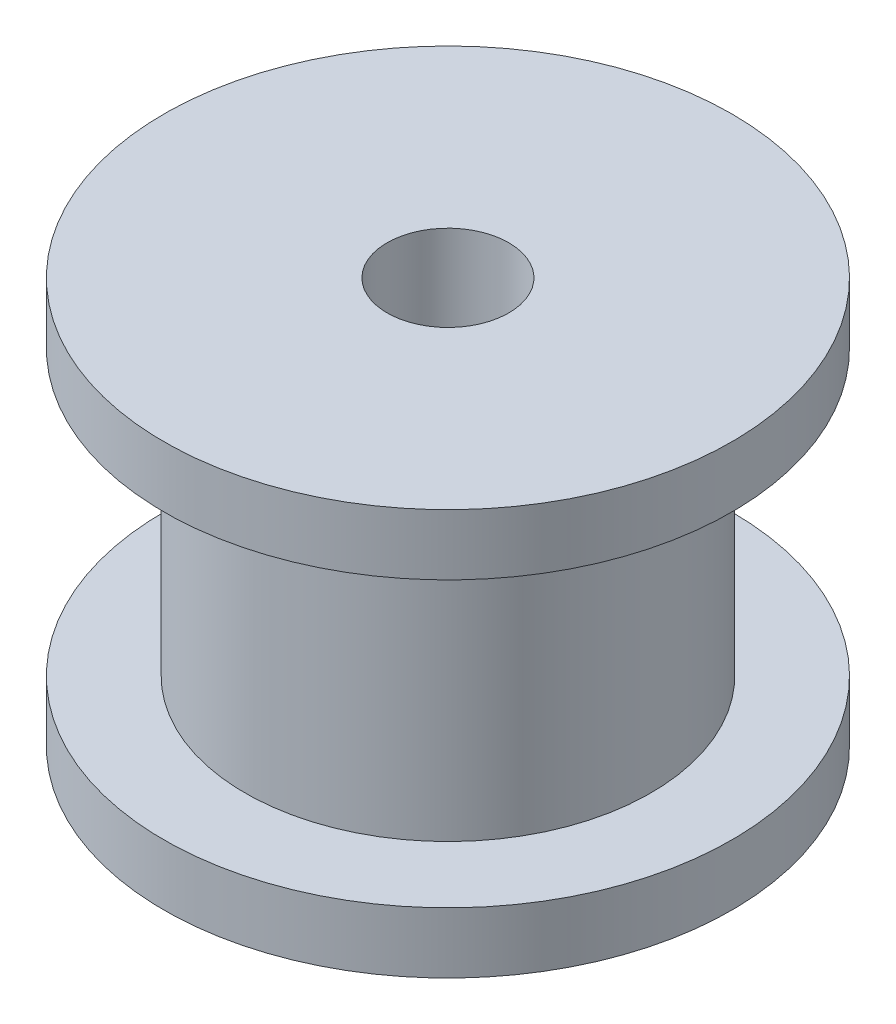
from build123d import *


with BuildPart() as part:
    # Sketch1 → Revolve1 (revolve)
    with BuildSketch(Plane.XY, mode=Mode.PRIVATE) as revolve1_sk:
        Polygon((1.5, 0), (7, 0), (7, 1.5), (5, 1.5), (5, 8.5), (7, 8.5), (7, 10), (1.5, 10), align=None)
    revolve(revolve1_sk.sketch.rotate(Axis((0, 0, 0), (0, 1, 0)), 90), axis=Axis((0, 0, 0), (0, 1, 0)))


solid = part.part
